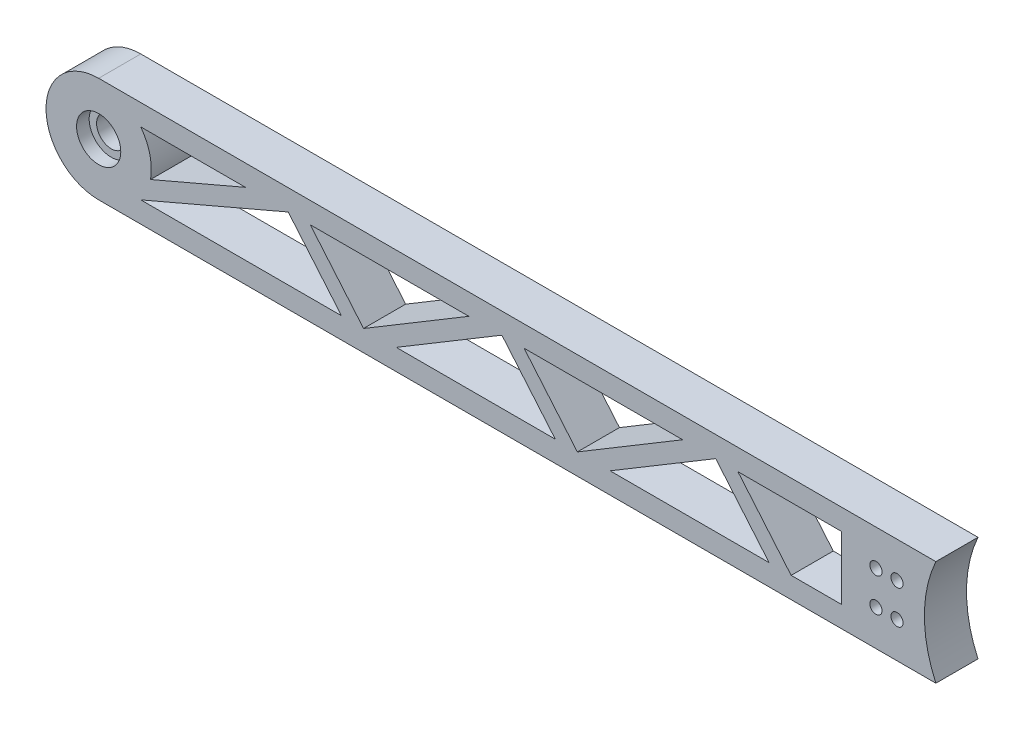
from build123d import *

# Parameters (mm, degrees)
EXTRUDE_1_DEPTH          = 10
CUT_EXTRUDE_1_DEPTH      = 252.652538235
CUT_EXTRUDE_1_DEPTH_BACK = 252.652538235
SKETCH_7_R               = 3.5
CUT_EXTRUDE_5_DEPTH      = 252.652538235
SKETCH_8_R               = 5
CUT_EXTRUDE_6_DEPTH      = 3
SKETCH_9_R               = 3
CUT_EXTRUDE_7_DEPTH      = 252.652538235
SKETCH_10_R              = 5.25
CUT_EXTRUDE_8_DEPTH      = 3
CUT_EXTRUDE_START        = -10
SKETCH_11_R              = 27
CUT_EXTRUDE_9_DEPTH      = 10
SKETCH_12_R              = 30
CUT_EXTRUDE_10_DEPTH     = 10
SKETCH_14_R              = 1.45
CUT_EXTRUDE_12_DEPTH     = 300


with BuildPart() as part:
    # 草图1 → 凸台-拉伸1 (new body)
    with BuildSketch(Plane.XY):
        with BuildLine():
            Line((0, 12.5), (199.067804112, 12.5))
            ThreePointArc((199.067804112, 12.5), (250, 0), (199.067804112, -12.5))
            Line((199.067804112, -12.5), (0, -12.5))
            ThreePointArc((0, -12.5), (-12.5, 0), (0, 12.5))
        make_face()
    extrude(amount=EXTRUDE_1_DEPTH)

    # 草图3 → 切除-拉伸1 (cut, two sides: drawn at the far end of the back side and taken through both)
    with BuildSketch(Plane.XY.offset(10).offset(-CUT_EXTRUDE_1_DEPTH_BACK)):
        Polygon((176.376805713, 7.5), (151.73545401, 7.5), (164.376805713, -7.5), (176.376805713, -7.5), align=None)
        Polygon((159.145761472, -7.5), (146.504409769, 7.5), (146.399203355, 7.5), (121.399203355, -7.5), align=None)
        Polygon((113.624600829, -7.5), (138.624600829, 7.5), (100.983249125, 7.5), align=None)
        Polygon((70.646998471, -7.5), (108.393556588, -7.5), (95.752204884, 7.5), (95.646998471, 7.5), align=None)
        Polygon((50.231044241, 7.5), (62.872395944, -7.5), (87.872395944, 7.5), align=None)
        Polygon((10, -7.5), (57.641351703, -7.5), (45, 7.5), align=None)
        with BuildLine():
            Line((34.845635859, 7.5), (10, 7.5))
            ThreePointArc((10, 7.5), (12.156331085, 2.910947362), (12.312475569, -2.157068696))
            Line((12.312475569, -2.157068696), (34.845635859, 7.5))
        make_face()
    extrude(amount=CUT_EXTRUDE_1_DEPTH + CUT_EXTRUDE_1_DEPTH_BACK, mode=Mode.SUBTRACT)

    # 草图7 → 切除-拉伸5 (cut, through all)
    with BuildSketch(Plane(origin=(0, 0, 0), x_dir=(-1, 0, 0), z_dir=(0, 0, -1))):
        Circle(SKETCH_7_R)
    extrude(amount=-CUT_EXTRUDE_5_DEPTH, mode=Mode.SUBTRACT)

    # 草图8 → 切除-拉伸6 (cut)
    with BuildSketch(Plane(origin=(0, 0, 0), x_dir=(-1, 0, 0), z_dir=(0, 0, -1))):
        with Locations((-223, 0)):
            Circle(SKETCH_8_R)
    extrude(amount=-CUT_EXTRUDE_6_DEPTH, mode=Mode.SUBTRACT)

    # 草图9 → 切除-拉伸7 (cut, through all)
    with BuildSketch(Plane(origin=(0, 0, 0), x_dir=(-1, 0, 0), z_dir=(0, 0, -1))):
        with Locations((-223, 0)):
            Circle(SKETCH_9_R)
    extrude(amount=-CUT_EXTRUDE_7_DEPTH, mode=Mode.SUBTRACT)

    # 草图10 → 切除-拉伸8 (cut)
    with BuildSketch(Plane.XY.offset(10)):
        Circle(SKETCH_10_R)
    extrude(amount=-CUT_EXTRUDE_8_DEPTH, mode=Mode.SUBTRACT)

    # 草图11 → 切除-拉伸9 (cut)
    with BuildSketch(Plane.XY.offset(10).offset(CUT_EXTRUDE_START)):
        with Locations((223, 0)):
            Circle(SKETCH_11_R)
    extrude(amount=CUT_EXTRUDE_9_DEPTH, mode=Mode.SUBTRACT)

    # 草图12 → 切除-拉伸10 (cut)
    with BuildSketch(Plane.XY.offset(10)):
        with Locations((226, 0)):
            Circle(SKETCH_12_R)
    extrude(amount=-CUT_EXTRUDE_10_DEPTH, mode=Mode.SUBTRACT)

    # 草图14 → 切除-拉伸12 (cut)
    with BuildSketch(Plane.XY.offset(10)):
        with Locations((184.5, 4)):
            Circle(SKETCH_14_R)
        with Locations((189.5, 4)):
            Circle(SKETCH_14_R)
        with Locations((189.5, -4)):
            Circle(SKETCH_14_R)
        with Locations((184.5, -4)):
            Circle(SKETCH_14_R)
    extrude(amount=-CUT_EXTRUDE_12_DEPTH, mode=Mode.SUBTRACT)


solid = part.part
